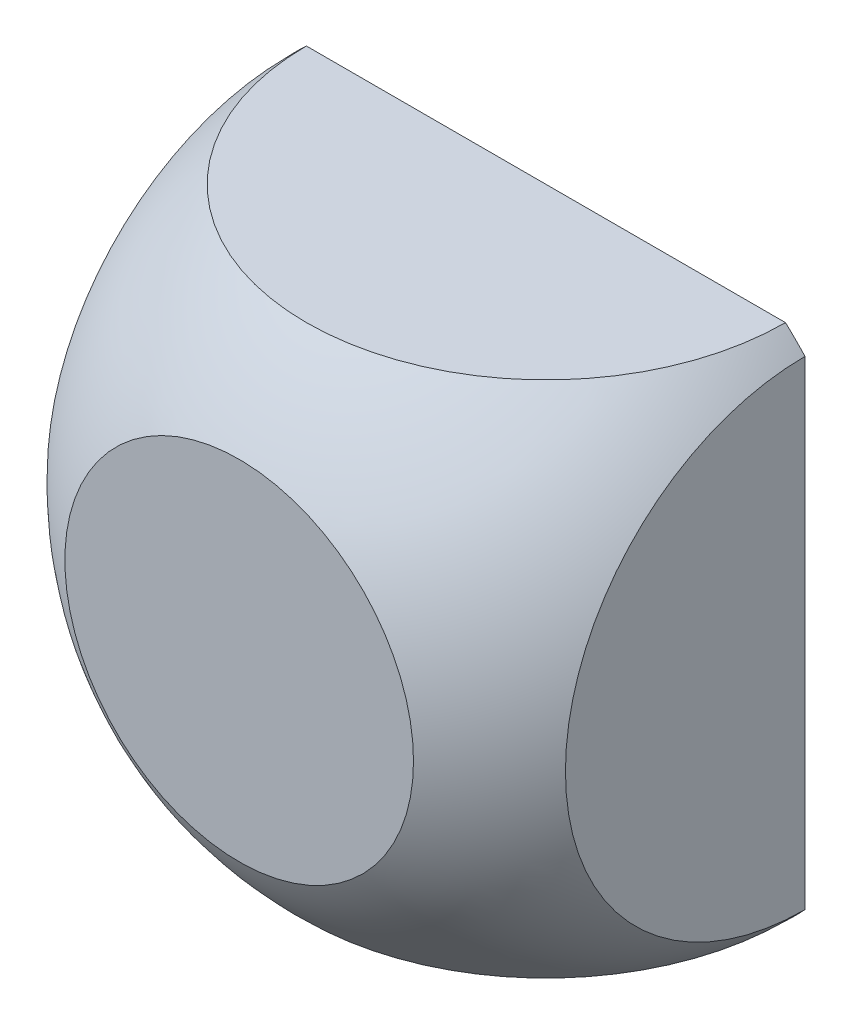
from build123d import *

# Parameters (mm, degrees)
ESBO_O4_W                = 76
ESBO_O4_H                = 76
RESSALTO_EXTRUS_O2_DEPTH = 45


with BuildPart() as part:
    # Esboço4 → Ressalto-extrusão2 (new body)
    with BuildSketch(Plane.XY):
        Rectangle(ESBO_O4_W, ESBO_O4_H)
    extrude(amount=RESSALTO_EXTRUS_O2_DEPTH)

    # Esboço5 → Corte-Revolução2 (revolve, cut)
    with BuildSketch(Plane(origin=(0, 0, 0), x_dir=(0, 0, -1), z_dir=(1, 0, 0))):
        with BuildLine():
            Line((-104.6568392, 0), (-51.757946877, 0))
            ThreePointArc((-51.757946877, 0), (0, 51.757946877), (51.757946877, 0))
            Line((51.757946877, 0), (104.6568392, 0))
            ThreePointArc((104.6568392, 0), (0, 104.6568392), (-104.6568392, 0))
        make_face()
    revolve(axis=Axis((0, 0, 104.6568392), (0, 0, -1)), mode=Mode.SUBTRACT)


solid = part.part
